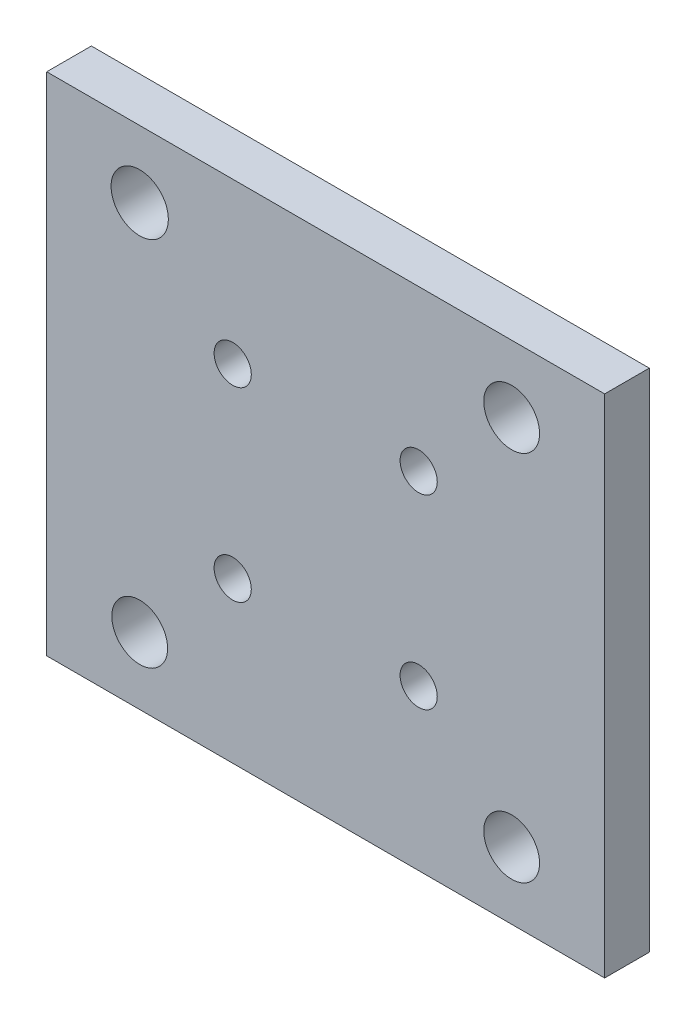
from build123d import *

# Parameters (mm, degrees)
SKETCH1_W           = 75
SKETCH1_H           = 68
SKETCH1_R           = 3.85
SKETCH1_R_2         = 3.75
SKETCH1_R_3         = 2.5
BOSS_EXTRUDE1_DEPTH = 6


with BuildPart() as part:
    # Sketch1 → Boss-Extrude1 (new body)
    with BuildSketch(Plane.XY):
        with Locations((37.5, 34)):
            Rectangle(SKETCH1_W, SKETCH1_H)
        with Locations((12.5, 59)):
            Circle(SKETCH1_R, mode=Mode.SUBTRACT)
        with Locations((62.5, 59)):
            Circle(SKETCH1_R_2, mode=Mode.SUBTRACT)
        with Locations((62.5, 9)):
            Circle(SKETCH1_R_2, mode=Mode.SUBTRACT)
        with Locations((12.5, 9)):
            Circle(SKETCH1_R_2, mode=Mode.SUBTRACT)
        with Locations((25, 46.5)):
            Circle(SKETCH1_R_3, mode=Mode.SUBTRACT)
        with Locations((50, 46.5)):
            Circle(SKETCH1_R_3, mode=Mode.SUBTRACT)
        with Locations((50, 21.5)):
            Circle(SKETCH1_R_3, mode=Mode.SUBTRACT)
        with Locations((25, 21.5)):
            Circle(SKETCH1_R_3, mode=Mode.SUBTRACT)
    extrude(amount=BOSS_EXTRUDE1_DEPTH)


solid = part.part
